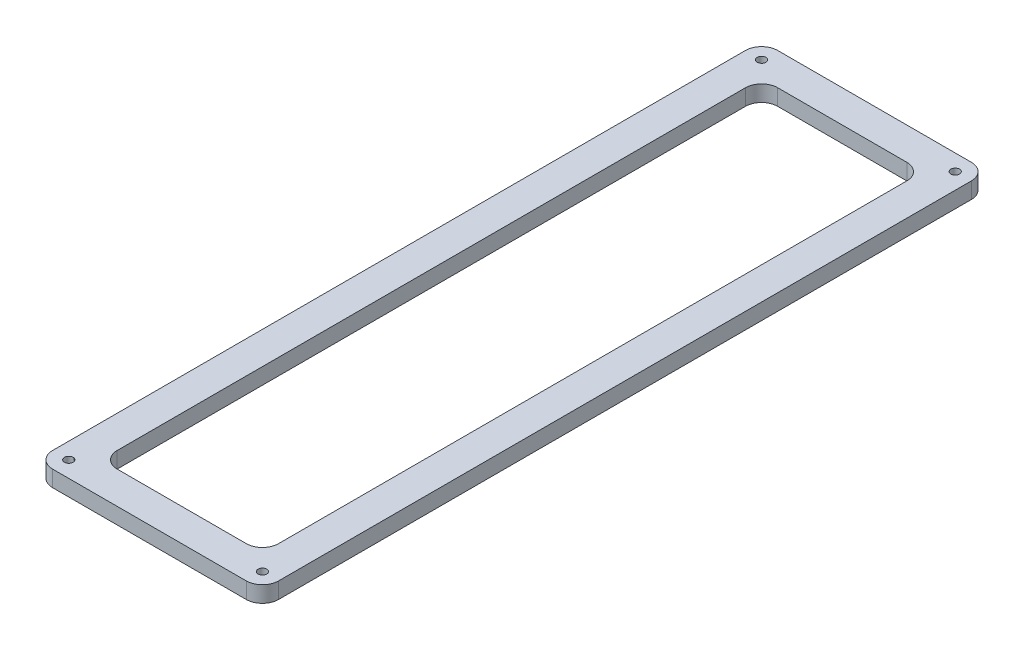
from build123d import *

# Parameters (mm, degrees)
SKETCH1_R           = 0.8509
BOSS_EXTRUDE1_DEPTH = 3.175


with BuildPart() as part:
    # Sketch1 → Boss-Extrude1 (new body)
    with BuildSketch(Plane(origin=(0, 0, 0), x_dir=(1, 0, 0), z_dir=(0, 1, 0))):
        with BuildLine():
            Line((0, -3.175), (38.1, -3.175))
            ThreePointArc((38.1, -3.175), (40.34506403, -2.24506403), (41.275, 0))
            Line((41.275, 0), (41.275, 136.313672))
            ThreePointArc((41.275, 136.313672), (40.34506403, 138.55873603), (38.1, 139.488672))
            Line((38.1, 139.488672), (0, 139.488672))
            ThreePointArc((0, 139.488672), (-2.24506403, 138.55873603), (-3.175, 136.313672))
            Line((-3.175, 136.313672), (-3.175, 0))
            ThreePointArc((-3.175, 0), (-2.24506403, -2.24506403), (0, -3.175))
        make_face()
        with Locations(Location((0, 136.313672, 0), (0, 0, 270))):
            Circle(SKETCH1_R, mode=Mode.SUBTRACT)
        with Locations(Location((38.1, 136.313672, 0), (0, 0, 270))):
            Circle(SKETCH1_R, mode=Mode.SUBTRACT)
        with Locations(Location((0, 0, 0), (0, 0, 270))):
            Circle(SKETCH1_R, mode=Mode.SUBTRACT)
        with Locations(Location((38.1, 0, 0), (0, 0, 270))):
            Circle(SKETCH1_R, mode=Mode.SUBTRACT)
        with BuildLine():
            Line((6.35, 133.138672), (31.75, 133.138672))
            ThreePointArc((31.75, 133.138672), (33.99506403, 132.20873603), (34.925, 129.963672))
            Line((34.925, 129.963672), (34.925, 6.35))
            ThreePointArc((34.925, 6.35), (33.99506403, 4.10493597), (31.75, 3.175))
            Line((31.75, 3.175), (6.35, 3.175))
            ThreePointArc((6.35, 3.175), (4.10493597, 4.10493597), (3.175, 6.35))
            Line((3.175, 6.35), (3.175, 129.963672))
            ThreePointArc((3.175, 129.963672), (4.10493597, 132.20873603), (6.35, 133.138672))
        make_face(mode=Mode.SUBTRACT)
    extrude(amount=BOSS_EXTRUDE1_DEPTH)


solid = part.part
